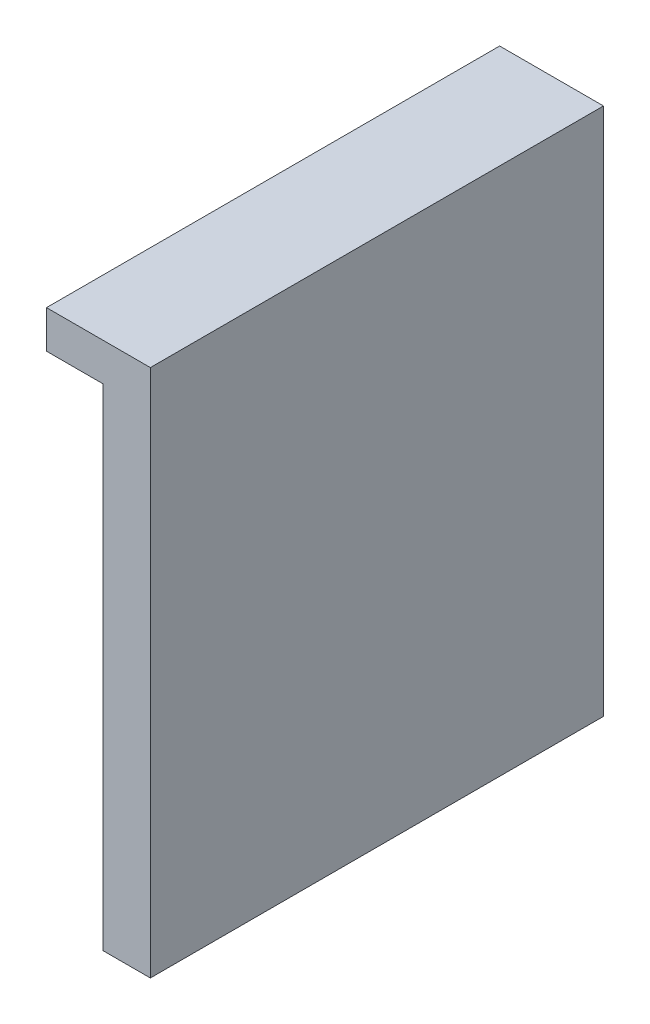
from build123d import *

# Parameters (mm, degrees)
SKETCH1_W           = 3
SKETCH1_H           = 24
BOSS_EXTRUDE1_DEPTH = 23
SKETCH2_W           = 6
SKETCH2_H           = 24
BOSS_EXTRUDE2_DEPTH = 2
SKETCH4_W           = 3
SKETCH4_H           = 24
BOSS_EXTRUDE3_DEPTH = 2
SKETCH5_W           = 24
SKETCH5_H           = 27
CUT_EXTRUDE1_DEPTH  = 0.5
SKETCH6_W           = 2.5
SKETCH6_H           = 24
BOSS_EXTRUDE4_DEPTH = 1


with BuildPart() as part:
    # Sketch1 → Boss-Extrude1 (new body)
    with BuildSketch(Plane(origin=(0, 0, 0), x_dir=(1, 0, 0), z_dir=(0, 1, 0))):
        with Locations((1.5, 12)):
            Rectangle(SKETCH1_W, SKETCH1_H)
    extrude(amount=BOSS_EXTRUDE1_DEPTH)

    # Sketch2 → Boss-Extrude2 (add)
    with BuildSketch(Plane(origin=(0, 23, 0), x_dir=(1, 0, 0), z_dir=(0, 1, 0))):
        with Locations((0, 12)):
            Rectangle(SKETCH2_W, SKETCH2_H)
    extrude(amount=BOSS_EXTRUDE2_DEPTH)

    # Sketch4 → Boss-Extrude3 (add)
    with BuildSketch(Plane.XZ):
        with Locations((1.5, -12)):
            Rectangle(SKETCH4_W, SKETCH4_H)
    extrude(amount=BOSS_EXTRUDE3_DEPTH)

    # Sketch5 → Cut-Extrude1 (cut)
    with BuildSketch(Plane(origin=(3, 0, 0), x_dir=(0, 0, -1), z_dir=(1, 0, 0))):
        with Locations((12, 11.5)):
            Rectangle(SKETCH5_W, SKETCH5_H)
    extrude(amount=-CUT_EXTRUDE1_DEPTH, mode=Mode.SUBTRACT)

    # Sketch6 → Boss-Extrude4 (add)
    with BuildSketch(Plane.XZ.offset(2)):
        with Locations((1.25, -12)):
            Rectangle(SKETCH6_W, SKETCH6_H)
    extrude(amount=BOSS_EXTRUDE4_DEPTH)


solid = part.part
